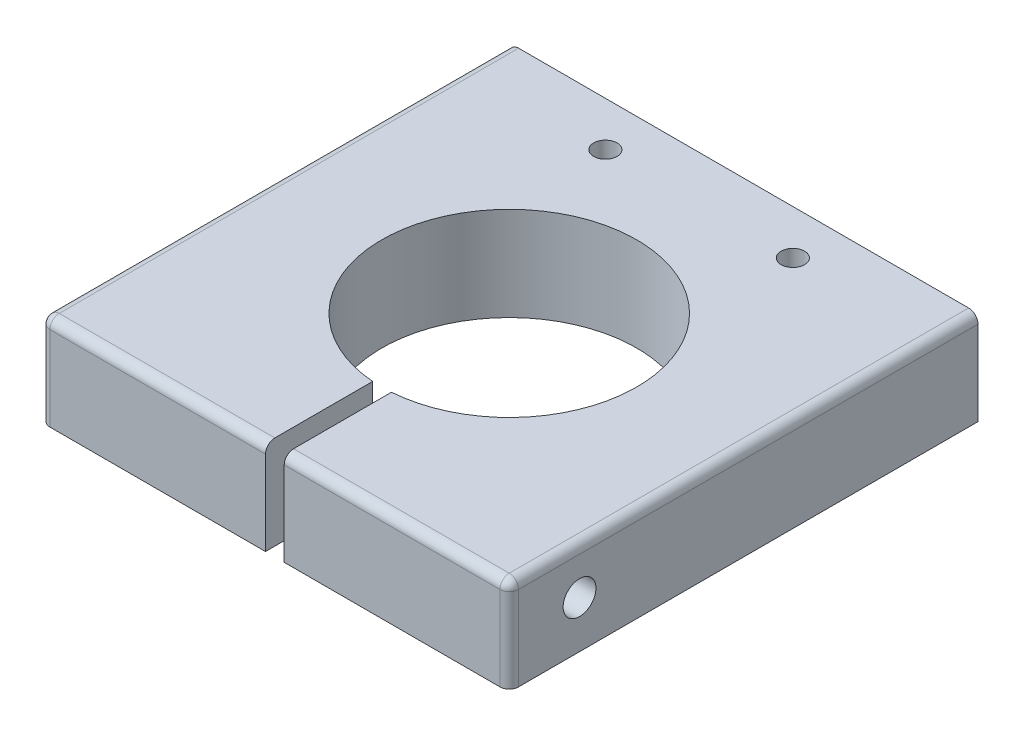
from build123d import *

# Parameters (mm, degrees)
BOSS_EXTRU_1_DEPTH      = 20
ESQUISSE2_R             = 27.2
ENL_V_MAT_EXTRU_1_DEPTH = 20
ESQUISSE3_R             = 2.5
ENL_V_MAT_EXTRU_2_DEPTH = 20
ESQUISSE4_R             = 3.5
ENL_V_MAT_EXTRU_3_DEPTH = 143.828568571
CONG_1_R                = 2


with BuildPart() as part:
    # Esquisse1 → Boss.-Extru.1 (new body)
    with BuildSketch(Plane(origin=(0, 0, 0), x_dir=(1, 0, 0), z_dir=(0, 1, 0))):
        Polygon((0, 0), (50, 0), (50, -100), (2, -100), (2, -50), (0, -50), align=None)
    boss_extru_1 = extrude(amount=BOSS_EXTRU_1_DEPTH)

    # Symétrie1: Boss.-Extru.1 across plane
    add(boss_extru_1.mirror(Plane(origin=(0, 0, 0), x_dir=(0, 0, 1), z_dir=(1, 0, 0))))

    # Esquisse2 → Enlèv. mat.-Extru.1 (cut)
    with BuildSketch(Plane(origin=(0, 20, 0), x_dir=(1, 0, 0), z_dir=(0, 1, 0))):
        with Locations((0, -50)):
            Circle(ESQUISSE2_R)
    extrude(amount=-ENL_V_MAT_EXTRU_1_DEPTH, mode=Mode.SUBTRACT)

    # Esquisse3 → Enlèv. mat.-Extru.2 (cut)
    with BuildSketch(Plane(origin=(0, 20, 0), x_dir=(1, 0, 0), z_dir=(0, 1, 0))):
        with Locations(Location((20, -9.5, 0), (0, 0, 270))):
            Circle(ESQUISSE3_R)
    enl_v_mat_extru_2 = extrude(amount=-ENL_V_MAT_EXTRU_2_DEPTH, mode=Mode.SUBTRACT)

    # Symétrie3: Enlèv. mat.-Extru.2 across plane
    add(enl_v_mat_extru_2.mirror(Plane(origin=(0, 0, 0), x_dir=(0, 0, 1), z_dir=(1, 0, 0))), mode=Mode.SUBTRACT)

    # Esquisse4 → Enlèv. mat.-Extru.3 (cut, through all)
    with BuildSketch(Plane(origin=(50, 0, 0), x_dir=(0, 0, -1), z_dir=(1, 0, 0))):
        with Locations((-85, 10)):
            Circle(ESQUISSE4_R)
    extrude(amount=-ENL_V_MAT_EXTRU_3_DEPTH, mode=Mode.SUBTRACT)

    # Congé1
    cong_1_edges = [part.edges().sort_by_distance(p)[0] for p in [
        (50, 10, 100),
        (26, 20, 100),
        (50, 20, 50),
        (-50, 20, 50),
        (-26, 20, 100),
        (-50, 10, 100),
    ]]
    fillet(cong_1_edges, radius=CONG_1_R)


solid = part.part
